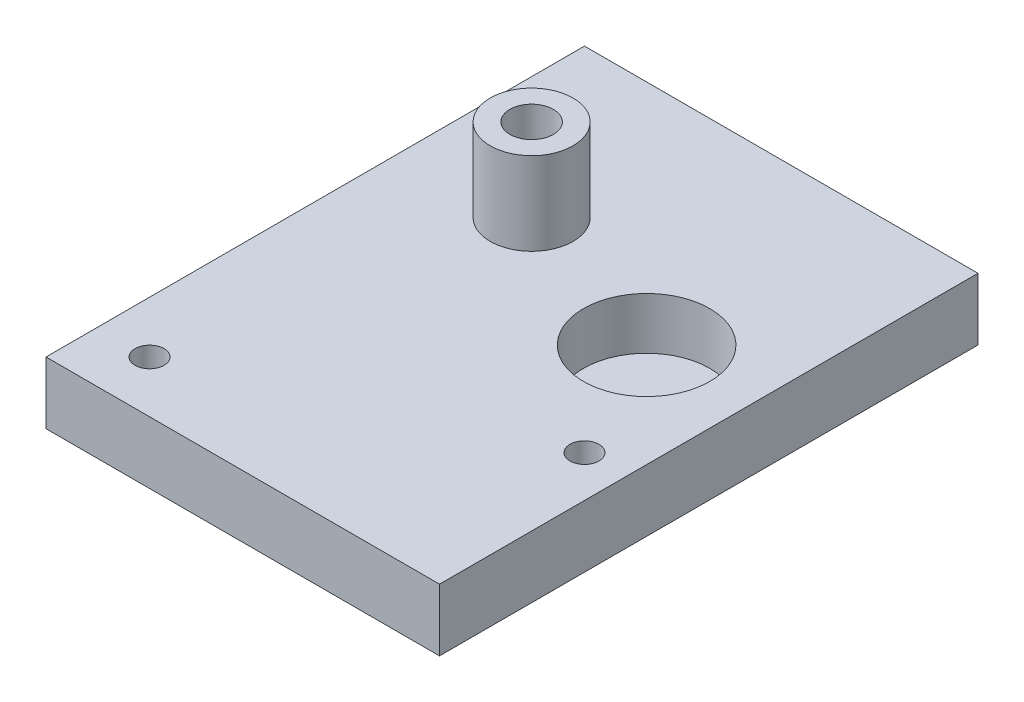
from build123d import *

# Parameters (mm, degrees)
SKETCH_1_W          = 19
SKETCH_1_H          = 26
EXTRUDE_1_DEPTH     = 3
CUT_EXTRUDE_START   = 3
SKETCH_1_3_R        = 3.05
SKETCH_1_3_R_2      = 1.05
CUT_EXTRUDE_1_DEPTH = 2.5
SKETCH_2_R          = 1
CUT_EXTRUDE_2_DEPTH = 1.5
SKETCH_2_3_R        = 0.7
CUT_EXTRUDE_3_DEPTH = 21.736441353
EXTRUDE_START       = 3
SKETCH_1_6_R        = 2
EXTRUDE_2_DEPTH     = 4
CUT_EXTRUDE_START_2 = 7
SKETCH_1_7_R        = 1.05
CUT_EXTRUDE_5_DEPTH = 4
SKETCH_3_R          = 0.3
CUT_EXTRUDE_6_DEPTH = 1.5


with BuildPart() as part:
    # 草图1 → 凸台-拉伸1 (new body)
    with BuildSketch(Plane(origin=(0, 0, 0), x_dir=(1, 0, 0), z_dir=(0, 1, 0))):
        with Locations((-4.5, -2)):
            Rectangle(SKETCH_1_W, SKETCH_1_H)
    extrude(amount=EXTRUDE_1_DEPTH)

    # 草图1<3> → 切除-拉伸1 (cut)
    with BuildSketch(Plane(origin=(0, 0, 0), x_dir=(1, 0, 0), z_dir=(0, 1, 0)).offset(CUT_EXTRUDE_START)):
        with Locations(Location((0, 0, 0), (0, 0, 90))):
            Circle(SKETCH_1_3_R)
        with Locations(Location((-8.107149516, 2.554237014, 0), (0, 0, 90))):
            Circle(SKETCH_1_3_R_2)
    extrude(amount=-CUT_EXTRUDE_1_DEPTH, mode=Mode.SUBTRACT)

    # 草图2 → 切除-拉伸2 (cut)
    with BuildSketch(Plane.XZ):
        with Locations(Location((-11.5, 12.5, 0), (0, 0, 270))):
            Circle(SKETCH_2_R)
        with Locations(Location((3, 6, 0), (0, 0, 270))):
            Circle(SKETCH_2_R)
    extrude(amount=-CUT_EXTRUDE_2_DEPTH, mode=Mode.SUBTRACT)

    # 草图2<3> → 切除-拉伸3 (cut, through all)
    with BuildSketch(Plane.XZ):
        with Locations(Location((-11.5, 12.5, 0), (0, 0, 270))):
            Circle(SKETCH_2_3_R)
        with Locations(Location((3, 6, 0), (0, 0, 270))):
            Circle(SKETCH_2_3_R)
    extrude(amount=-CUT_EXTRUDE_3_DEPTH, mode=Mode.SUBTRACT)

    # 草图1<6> → 凸台-拉伸2 (add)
    with BuildSketch(Plane(origin=(0, 0, 0), x_dir=(1, 0, 0), z_dir=(0, 1, 0)).offset(EXTRUDE_START)):
        with Locations(Location((-8.107149516, 2.554237014, 0), (0, 0, 90))):
            Circle(SKETCH_1_6_R)
    extrude(amount=EXTRUDE_2_DEPTH)

    # 草图1<7> → 切除-拉伸5 (cut)
    with BuildSketch(Plane(origin=(0, 0, 0), x_dir=(1, 0, 0), z_dir=(0, 1, 0)).offset(CUT_EXTRUDE_START_2)):
        with Locations(Location((-8.107149516, 2.554237014, 0), (0, 0, 90))):
            Circle(SKETCH_1_7_R)
    extrude(amount=-CUT_EXTRUDE_5_DEPTH, mode=Mode.SUBTRACT)

    # 草图3 → 切除-拉伸6 (cut)
    with BuildSketch(Plane.XY.offset(-11)):
        with Locations((0.8, 1.5)):
            Circle(SKETCH_3_R)
        with Locations((-4.2, 1.5)):
            Circle(SKETCH_3_R)
    extrude(amount=CUT_EXTRUDE_6_DEPTH, mode=Mode.SUBTRACT)


solid = part.part
